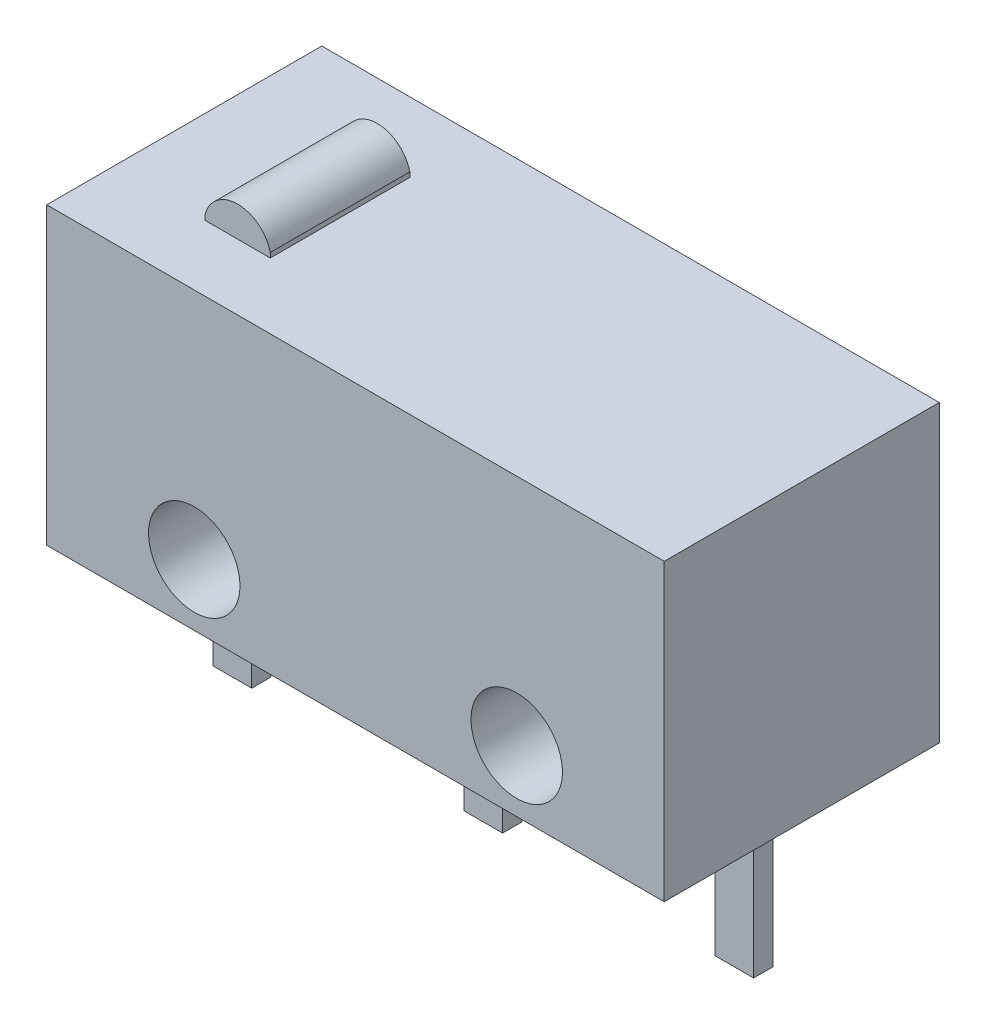
from build123d import *

# Parameters (mm, degrees)
SKETCH1_W          = 5.715
SKETCH1_H          = 6.127
EXTRUDE1_DEPTH     = 12.83
SKETCH2_R          = 0.95
CUT_EXTRUDE1_DEPTH = 20.8
SKETCH4_W          = 0.8
SKETCH4_H          = 0.4
EXTRUDE2_DEPTH     = 3.1
EXTRUDE5_DEPTH     = 2.9


with BuildPart() as part:
    # Sketch1 → Extrude1 (new body)
    with BuildSketch(Plane(origin=(3.15, 0, 0), x_dir=(0, 0, -1), z_dir=(1, 0, 0))):
        with Locations((0.0425, 1.5635)):
            Rectangle(SKETCH1_W, SKETCH1_H)
    extrude(amount=-EXTRUDE1_DEPTH)

    # Sketch2 → Cut-Extrude1 (cut)
    with BuildSketch(Plane.XY.offset(2.815)):
        with Locations(Location((0.085, -0.223, 0), (0, 0, 180))):
            Circle(SKETCH2_R)
        with Locations((-6.615, -0.223)):
            Circle(SKETCH2_R)
    extrude(amount=-CUT_EXTRUDE1_DEPTH, mode=Mode.SUBTRACT)

    # Sketch4 → Extrude2 (add)
    with BuildSketch(Plane.XZ.offset(1.5)):
        with Locations((-8.48, -0.0425)):
            Rectangle(SKETCH4_W, SKETCH4_H)
        with Locations((-3.265, -0.0425)):
            Rectangle(SKETCH4_W, SKETCH4_H)
        with Locations((1.95, -0.0425)):
            Rectangle(SKETCH4_W, SKETCH4_H)
    extrude(amount=EXTRUDE2_DEPTH)

    # Sketch7 → Extrude5 (add)
    with BuildSketch(Plane(origin=(0, 0, -1.45), x_dir=(-1, 0, 0), z_dir=(0, 0, -1))):
        with BuildLine():
            Line((7.755679036, 4.627), (6.400179952, 4.627))
            Line((6.400179952, 4.627), (6.400179952, 4.727))
            ThreePointArc((6.400179952, 4.727), (7.077929494, 5.259200233), (7.755679036, 4.727))
            Line((7.755679036, 4.727), (7.755679036, 4.627))
        make_face()
    extrude(amount=-EXTRUDE5_DEPTH)


solid = part.part
